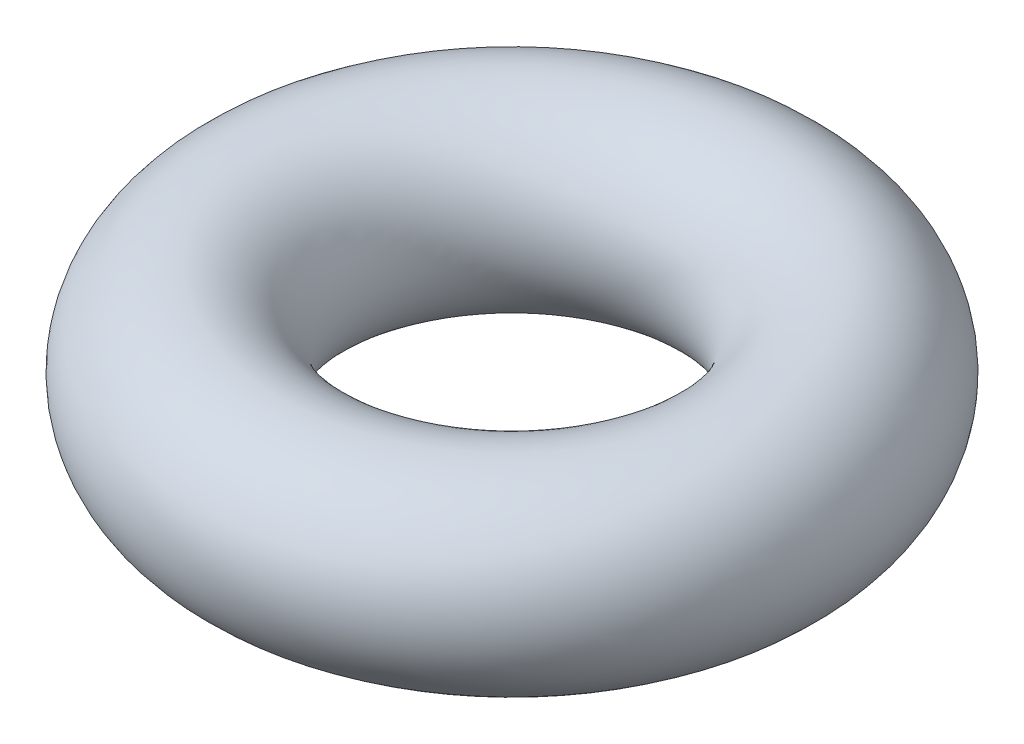
from build123d import *

# Parameters (mm, degrees)
SKETCH1_R   = 25.4
SKETCH1_R_2 = 23.8125


with BuildPart() as part:
    # Sketch1 → Revolve2 (revolve)
    with BuildSketch(Plane.XY, mode=Mode.PRIVATE) as revolve2_sk:
        Circle(SKETCH1_R)
        Circle(SKETCH1_R_2, mode=Mode.SUBTRACT)
    revolve(revolve2_sk.sketch.rotate(Axis((63.5, 33.286272064, 0), (0, -1, 0)), 90), axis=Axis((63.5, 33.286272064, 0), (0, -1, 0)))


solid = part.part
